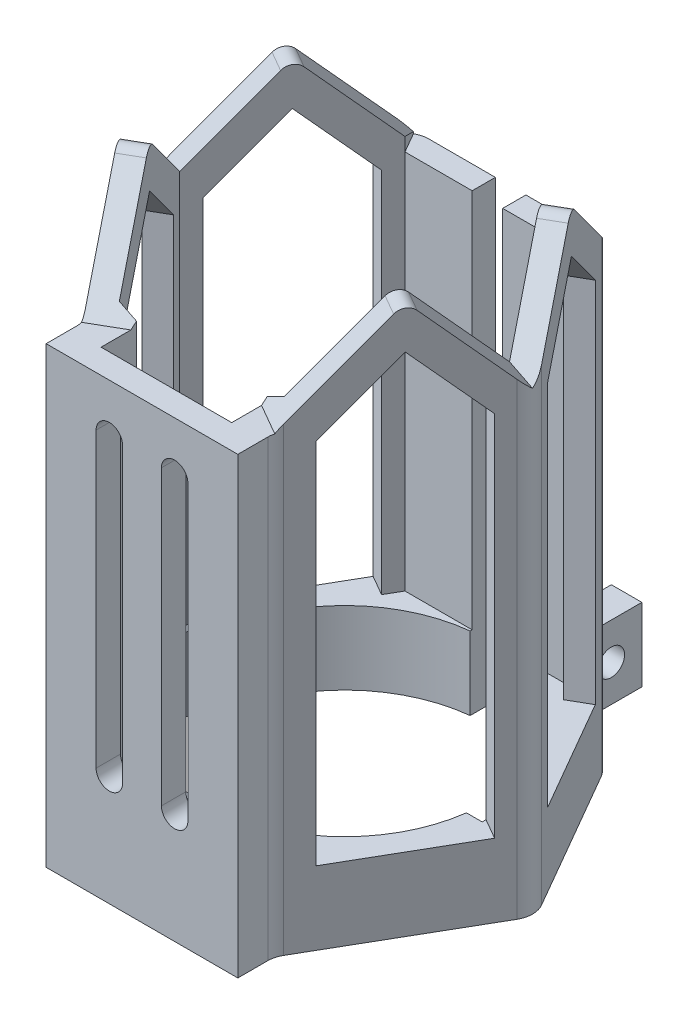
from build123d import *

# Parameters (mm, degrees)
BOSS_EXTRUDE1_DEPTH  = 114.3
SKETCH2_W            = 6.35
SKETCH2_H            = 17.78
CUT_EXTRUDE2_DEPTH   = 99.06
SKETCH3_W            = 27.183356596
SKETCH3_H            = 83.82
CUT_EXTRUDE3_DEPTH   = 99.06
SKETCH4_W            = 27.183356596
SKETCH4_H            = 83.82
CUT_EXTRUDE4_DEPTH   = 99.06
SKETCH7_W            = 3.263536018
SKETCH7_H            = 7.713600016
CUT_EXTRUDE7_DEPTH   = 15.24
CUT_EXTRUDE8_DEPTH   = 99.06
SKETCH10_W           = 39.883356596
SKETCH10_H           = 114.3
BOSS_EXTRUDE2_DEPTH  = 7.62
CUT_EXTRUDE11_DEPTH  = 81.28
BOSS_EXTRUDE9_DEPTH  = 4.826
MIRROR9_COPY_1_DEPTH = 4.826
MIRROR9_COPY_2_DEPTH = 4.826
CUT_EXTRUDE13_DEPTH  = 19.941678176
CUT_EXTRUDE14_DEPTH  = 19.941678176
SKETCH17_W           = 27.183356538
SKETCH17_H           = 4.826
CUT_EXTRUDE15_DEPTH  = 99.06
SKETCH18_W           = 39.883356596
SKETCH18_H           = 7.62
CUT_EXTRUDE16_DEPTH  = 19.941678176
CUT_EXTRUDE18_DEPTH  = 19.941678176
SKETCH20_W           = 27.183356538
SKETCH20_H           = 2.54
CUT_EXTRUDE19_DEPTH  = 79.118321824
FILLET1_R            = 5.08
FILLET2_R            = 2.54
SKETCH21_R           = 2.749999961
CUT_EXTRUDE20_DEPTH  = 79.118321824


with BuildPart() as part:
    # Sketch1 → Boss-Extrude1 (new body)
    with BuildSketch(Plane(origin=(0, 0, 0), x_dir=(1, 0, 0), z_dir=(0, 1, 0))):
        with BuildLine():
            Line((39.883356596, 0), (19.941678298, 34.54))
            Line((19.941678298, 34.54), (9.525, 34.54))
            Line((9.525, 34.54), (9.525, 52.32))
            Line((9.525, 52.32), (3.175, 52.32))
            Line((3.175, 52.32), (3.175, 34.54))
            Line((3.175, 34.54), (3.175, 29.28841025))
            ThreePointArc((3.175, 29.28841025), (0, -29.46), (-3.175, 29.28841025))
            Line((-3.175, 29.28841025), (-3.175, 34.54))
            Line((-3.175, 34.54), (-3.175, 52.32))
            Line((-3.175, 52.32), (-9.525, 52.32))
            Line((-9.525, 52.32), (-9.525, 34.54))
            Line((-9.525, 34.54), (-19.941678298, 34.54))
            Line((-19.941678298, 34.54), (-39.883356596, 0))
            Line((-39.883356596, 0), (-19.941678298, -34.54))
            Line((-19.941678298, -34.54), (19.941678298, -34.54))
            Line((19.941678298, -34.54), (39.883356596, 0))
        make_face()
    extrude(amount=BOSS_EXTRUDE1_DEPTH)

    # Sketch2 → Cut-Extrude2 (cut)
    with BuildSketch(Plane(origin=(0, 114.3, 0), x_dir=(1, 0, 0), z_dir=(0, 1, 0))):
        with Locations((-6.35, 43.43)):
            Rectangle(SKETCH2_W, SKETCH2_H)
        with Locations((6.35, 43.43)):
            Rectangle(SKETCH2_W, SKETCH2_H)
    extrude(amount=-CUT_EXTRUDE2_DEPTH, mode=Mode.SUBTRACT)

    # Sketch3 → Cut-Extrude3 (cut)
    with BuildSketch(Plane(origin=(-29.912517447, 0, -17.27), x_dir=(-0.49999999999999617, 0, 0.8660254037844409), z_dir=(-0.8660254037844408, 0, -0.4999999999999961))):
        with Locations((0, 57.15)):
            Rectangle(SKETCH3_W, SKETCH3_H)
    extrude(amount=-CUT_EXTRUDE3_DEPTH, mode=Mode.SUBTRACT)

    # Sketch4 → Cut-Extrude4 (cut)
    with BuildSketch(Plane(origin=(29.912517447, 0, -17.27), x_dir=(-0.500000000000004, 0, -0.8660254037844364), z_dir=(0.8660254037844365, 0, -0.500000000000004))):
        with Locations((0, 57.15)):
            Rectangle(SKETCH4_W, SKETCH4_H)
    extrude(amount=-CUT_EXTRUDE4_DEPTH, mode=Mode.SUBTRACT)

    # Sketch7 → Cut-Extrude7 (cut)
    with BuildSketch(Plane.XZ):
        with Locations((-30.838217531, 0)):
            Rectangle(SKETCH7_W, SKETCH7_H)
        with Locations((30.838217531, 0)):
            Rectangle(SKETCH7_W, SKETCH7_H)
    extrude(amount=-CUT_EXTRUDE7_DEPTH, mode=Mode.SUBTRACT)

    # Sketch8 → Cut-Extrude8 (cut)
    with BuildSketch(Plane(origin=(0, 114.3, 0), x_dir=(1, 0, 0), z_dir=(0, 1, 0))):
        Polygon((-3.175, 29.714), (3.175, 29.714), (17.155385899, 29.714), (34.310771797, 0), (17.155385899, -29.714), (-17.155385899, -29.714), (-34.310771797, 0), (-17.155385899, 29.714), align=None)
    extrude(amount=-CUT_EXTRUDE8_DEPTH, mode=Mode.SUBTRACT)

    # Sketch10 → Boss-Extrude2 (add)
    with BuildSketch(Plane.XY.offset(34.54)):
        with Locations((0, 57.15)):
            Rectangle(SKETCH10_W, SKETCH10_H)
    extrude(amount=BOSS_EXTRUDE2_DEPTH)

    # Sketch12 → Cut-Extrude11 (cut)
    with BuildSketch(Plane(origin=(-29.912517447, 0, -17.27), x_dir=(-0.4999999999999998, 0, 0.8660254037844388), z_dir=(-0.8660254037844388, 0, -0.4999999999999998))):
        Polygon((19.941678298, 114.3), (0, 114.3), (19.941678298, 94.358321702), align=None)
        Polygon((-19.941678298, 94.358321702), (0, 114.3), (-19.941678298, 114.3), align=None)
        Polygon((6.259743879, 99.06), (0, 105.319743879), (-6.259743879, 99.06), align=None)
    cut_extrude11 = extrude(amount=-CUT_EXTRUDE11_DEPTH, mode=Mode.SUBTRACT)

    # Mirror2: Cut-Extrude11 across plane
    add(cut_extrude11.mirror(Plane(origin=(0, 0, 0), x_dir=(0, 0, 1), z_dir=(1, 0, 0))), mode=Mode.SUBTRACT)

    # Sketch11 → Boss-Extrude9 (add)
    with BuildSketch(Plane(origin=(-29.912517447, 0, -17.27), x_dir=(-0.4999999999999998, 0, 0.8660254037844388), z_dir=(-0.8660254037844388, 0, -0.4999999999999998))):
        Polygon((-13.591678298, 91.728065581), (0, 105.319743879), (13.591678298, 91.728065581), (19.941678298, 94.358321702), (0, 114.3), (-19.941678298, 94.358321702), align=None)
    boss_extrude9 = extrude(amount=-BOSS_EXTRUDE9_DEPTH)

    # Mirror8: Boss-Extrude9 across plane
    add(boss_extrude9.mirror(Plane.XY))

    # Mirror9 copy 1 sketch → Mirror9 copy 1 (add)
    with BuildSketch(Plane(origin=(29.912517447, 0, 17.27), x_dir=(0.4999999999999998, 0, -0.8660254037844388), z_dir=(0.8660254037844388, 0, 0.4999999999999998))):
        Polygon((-13.591678298, 91.728065581), (0, 105.319743879), (13.591678298, 91.728065581), (19.941678298, 94.358321702), (0, 114.3), (-19.941678298, 94.358321702), align=None)
    extrude(amount=-MIRROR9_COPY_1_DEPTH)

    # Mirror9 copy 2 sketch → Mirror9 copy 2 (add)
    with BuildSketch(Plane(origin=(29.912517447, 0, -17.27), x_dir=(0.4999999999999998, 0, 0.8660254037844388), z_dir=(0.8660254037844388, 0, -0.4999999999999998))):
        Polygon((-13.591678298, -91.728065581), (0, -105.319743879), (13.591678298, -91.728065581), (19.941678298, -94.358321702), (0, -114.3), (-19.941678298, -94.358321702), align=None)
    extrude(amount=-MIRROR9_COPY_2_DEPTH)

    # Sketch15 → Cut-Extrude13 (cut)
    with BuildSketch(Plane(origin=(0, 114.3, 0), x_dir=(1, 0, 0), z_dir=(0, 1, 0))):
        Polygon((-17.155385899, 29.714), (-19.941678298, 34.54), (19.941678298, 34.54), (17.155385899, 29.714), align=None)
    extrude(amount=-CUT_EXTRUDE13_DEPTH, mode=Mode.SUBTRACT)

    # Sketch16 → Cut-Extrude14 (cut)
    with BuildSketch(Plane(origin=(0, 114.3, 0), x_dir=(1, 0, 0), z_dir=(0, 1, 0))):
        Polygon((-19.941678298, -34.54), (19.941678298, -34.54), (11.5828011, -29.714), (-11.5828011, -29.714), align=None)
    extrude(amount=-CUT_EXTRUDE14_DEPTH, mode=Mode.SUBTRACT)

    # Sketch17 → Cut-Extrude15 (cut)
    with BuildSketch(Plane(origin=(0, 114.3, 0), x_dir=(1, 0, 0), z_dir=(0, 1, 0))):
        with Locations((0, -32.127)):
            Rectangle(SKETCH17_W, SKETCH17_H)
    extrude(amount=-CUT_EXTRUDE15_DEPTH, mode=Mode.SUBTRACT)

    # Sketch18 → Cut-Extrude16 (cut)
    with BuildSketch(Plane(origin=(0, 114.3, 0), x_dir=(1, 0, 0), z_dir=(0, 1, 0))):
        with Locations((0, -38.35)):
            Rectangle(SKETCH18_W, SKETCH18_H)
    extrude(amount=-CUT_EXTRUDE16_DEPTH, mode=Mode.SUBTRACT)

    # Sketch19 → Cut-Extrude18 (cut)
    with BuildSketch(Plane.XY.offset(42.16)):
        with BuildLine():
            Line((-9.545839134, 23.07), (-9.545839134, 83.988321824))
            ThreePointArc((-9.545839134, 83.988321824), (-6.795839134, 86.738321824), (-4.045839134, 83.988321824))
            Line((-4.045839134, 83.988321824), (-4.045839134, 23.07))
            ThreePointArc((-4.045839134, 23.07), (-6.795839134, 20.32), (-9.545839134, 23.07))
        make_face()
        with BuildLine():
            Line((9.545839134, 23.07), (9.545839134, 83.988321824))
            ThreePointArc((9.545839134, 83.988321824), (6.795839134, 86.738321824), (4.045839134, 83.988321824))
            Line((4.045839134, 83.988321824), (4.045839134, 23.07))
            ThreePointArc((4.045839134, 23.07), (6.795839134, 20.32), (9.545839134, 23.07))
        make_face()
    extrude(amount=-CUT_EXTRUDE18_DEPTH, mode=Mode.SUBTRACT)

    # Sketch20 → Cut-Extrude19 (cut)
    with BuildSketch(Plane(origin=(0, 94.358321824, 0), x_dir=(1, 0, 0), z_dir=(0, 1, 0))):
        with Locations((0, -35.81)):
            Rectangle(SKETCH20_W, SKETCH20_H)
    extrude(amount=-CUT_EXTRUDE19_DEPTH, mode=Mode.SUBTRACT)

    # Fillet1
    fillet1_edges = [part.edges().sort_by_distance(p)[0] for p in [
        (19.941678298, 47.179160851, 34.54),
        (-39.883356596, 47.179160851, 0),
        (-19.941678298, 47.179160851, -34.54),
        (39.883356596, 47.179160851, 0),
        (-19.941678298, 47.179160851, 34.54),
        (19.941678298, 47.179160851, -34.54),
        (-9.525, 7.62, -34.54),
        (9.525, 7.62, -34.54),
    ]]
    fillet(fillet1_edges, radius=FILLET1_R)

    # Fillet2
    fillet2_edges = [part.edges().sort_by_distance(p)[0] for p in [
        (27.822798147, 114.3, 16.0635),
        (-27.822798147, 114.3, -16.0635),
        (-27.822798147, 114.3, 16.0635),
        (27.822798147, 114.3, -16.0635),
    ]]
    fillet(fillet2_edges, radius=FILLET2_R)

    # Sketch21 → Cut-Extrude20 (cut)
    with BuildSketch(Plane(origin=(9.525, 0, 0), x_dir=(0, 0, -1), z_dir=(1, 0, 0))):
        with Locations((45.97, 7.62)):
            Circle(SKETCH21_R)
    extrude(amount=-CUT_EXTRUDE20_DEPTH, mode=Mode.SUBTRACT)


solid = part.part
